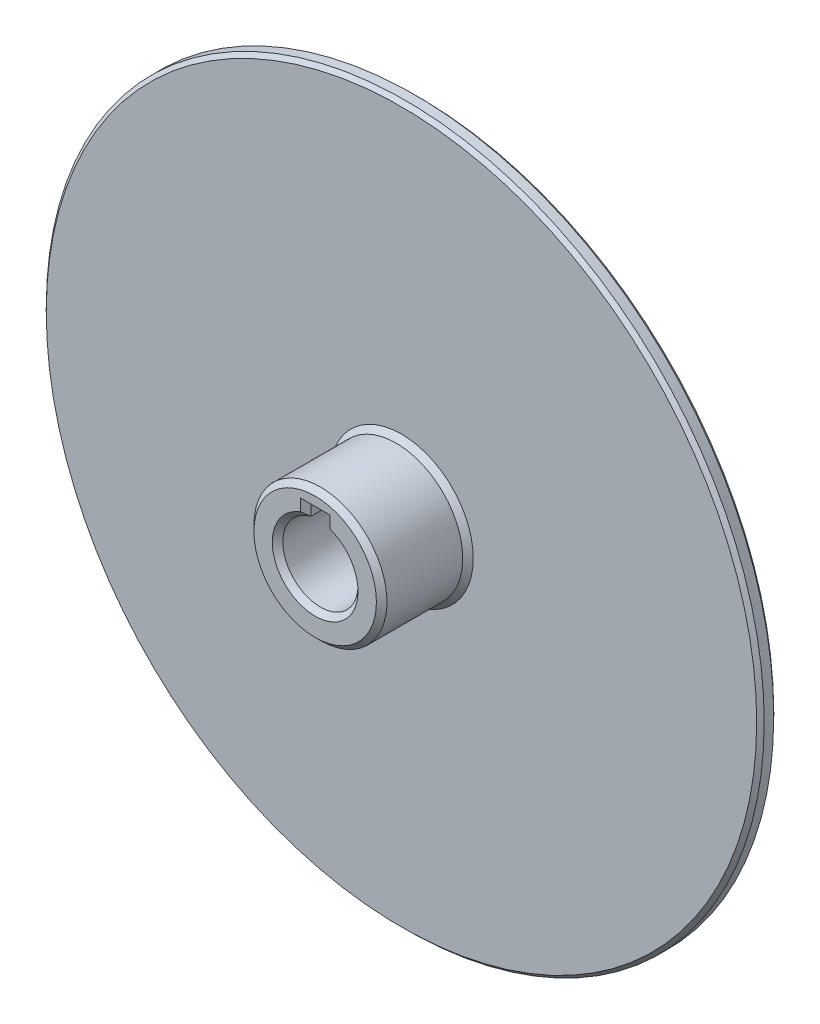
from build123d import *

# Parameters (mm, degrees)
SKETCH1_R               = 121.331498574
BOSS_EXTRUDE1_DEPTH     = 5.7658
SKETCH2_R               = 22.479
BOSS_EXTRUDE2_DEPTH     = 29.174948
CUT_EXTRUDE1_DEPTH      = 176.110025307
CUT_EXTRUDE1_DEPTH_BACK = 176.110025307
SKETCH3_R               = 12.7
CUT_EXTRUDE2_DEPTH      = 176.110025307
CUT_EXTRUDE2_DEPTH_BACK = 176.110025307
SKETCH4_W               = 6.35
SKETCH4_H               = 6.35
CHAMFER1_SIZE           = 1.27
CHAMFER2_SIZE           = 1.778


with BuildPart() as part:
    # Sketch1 → Boss-Extrude1 (new body)
    with BuildSketch(Plane.XY):
        with Locations(Location((0, 0, 0), (0, 0, 180))):
            Circle(SKETCH1_R)
    extrude(amount=BOSS_EXTRUDE1_DEPTH)

    # Sketch2 → Boss-Extrude2 (add)
    with BuildSketch(Plane.XY.offset(5.7658)):
        with Locations(Location((0, 0, 0), (0, 0, 180))):
            Circle(SKETCH2_R)
    extrude(amount=BOSS_EXTRUDE2_DEPTH)

    # Sketch3 → Cut-Extrude1 (cut, two sides: drawn at the far end of the back side and taken through both)
    with BuildSketch(Plane.XY.offset(34.940748).offset(-CUT_EXTRUDE1_DEPTH_BACK)):
        Circle(SKETCH3_R)
    extrude(amount=CUT_EXTRUDE1_DEPTH + CUT_EXTRUDE1_DEPTH_BACK, mode=Mode.SUBTRACT)

    # Sketch4 → Cut-Extrude2 (cut, two sides: drawn at the far end of the back side and taken through both)
    with BuildSketch(Plane.XY.offset(34.940748).offset(-CUT_EXTRUDE2_DEPTH_BACK)):
        with Locations((0, 12.7)):
            Rectangle(SKETCH4_W, SKETCH4_H)
    extrude(amount=CUT_EXTRUDE2_DEPTH + CUT_EXTRUDE2_DEPTH_BACK, mode=Mode.SUBTRACT)

    # Chamfer1
    chamfer1_edges = [part.edges().sort_by_distance(p)[0] for p in [
        (121.331498574, 0, 0),
        (121.331498574, 0, 5.7658),
    ]]
    chamfer(chamfer1_edges, length=CHAMFER1_SIZE)

    # Chamfer2
    chamfer2_edges = [part.edges().sort_by_distance(p)[0] for p in [
        (0, -12.7, 34.940748),
        (0, -12.7, 0),
        (0, 15.875, 34.940748),
        (3.175, 14.085861062, 34.940748),
        (-3.175, 14.085861062, 34.940748),
        (3.175, 14.085861062, 0),
        (-3.175, 14.085861062, 0),
        (0, 15.875, 0),
        (22.479, 0, 5.7658),
        (22.479, 0, 34.940748),
    ]]
    chamfer(chamfer2_edges, length=CHAMFER2_SIZE)


solid = part.part
